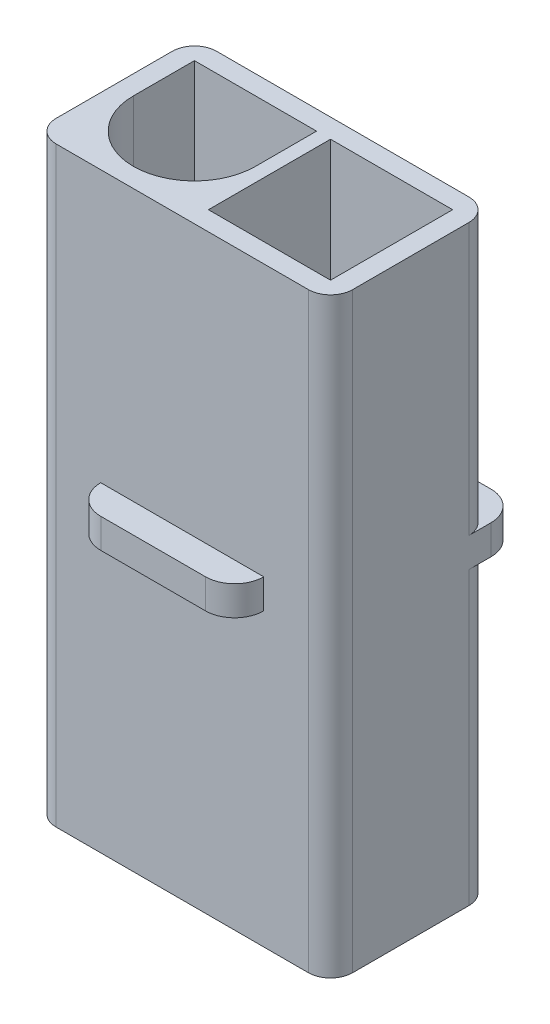
from build123d import *

# Parameters (mm, degrees)
SKETCH1_W           = 13.36
SKETCH1_H           = 7.23
BOSS_EXTRUDE1_DEPTH = 13.325
SKETCH2_W           = 5.5
SKETCH2_H           = 5.5
CUT_EXTRUDE1_DEPTH  = 10
CUT_EXTRUDE2_START  = -11.75
SKETCH3_R           = 2.75
CUT_EXTRUDE2_DEPTH  = 11.75
BOSS_EXTRUDE2_DEPTH = 1.8
BOSS_EXTRUDE3_DEPTH = 1.33
FILLET1_R           = 1


with BuildPart() as part:
    # Sketch1 → Boss-Extrude1 (new, symmetric)
    with BuildSketch(Plane(origin=(0, 0, 0), x_dir=(1, 0, 0), z_dir=(0, 1, 0))):
        Rectangle(SKETCH1_W, SKETCH1_H)
    extrude(amount=BOSS_EXTRUDE1_DEPTH, both=True)

    # Sketch2 → Cut-Extrude1 (cut)
    with BuildSketch(Plane(origin=(0, 13.325, 0), x_dir=(1, 0, 0), z_dir=(0, 1, 0))):
        with BuildLine():
            Line((-5.815, 2.75), (-0.315, 2.75))
            Line((-0.315, 2.75), (-0.315, 0))
            ThreePointArc((-0.315, 0), (-3.065, -2.75), (-5.815, 0))
            Line((-5.815, 0), (-5.815, 2.75))
        make_face()
        with Locations((3.065, 0)):
            Rectangle(SKETCH2_W, SKETCH2_H)
    extrude(amount=-CUT_EXTRUDE1_DEPTH, mode=Mode.SUBTRACT)

    # Sketch3 → Cut-Extrude2 (cut)
    with BuildSketch(Plane.XZ.offset(13.325).offset(CUT_EXTRUDE2_START)):
        with Locations(Location((-3.065, 0, 0), (0, 0, 270))):
            Circle(SKETCH3_R)
        with Locations(Location((3.065, 0, 0), (0, 0, 270))):
            Circle(SKETCH3_R)
    extrude(amount=CUT_EXTRUDE2_DEPTH, mode=Mode.SUBTRACT)

    # Sketch4 → Boss-Extrude2 (add, symmetric)
    with BuildSketch(Plane(origin=(0, 0, 0), x_dir=(0, 0, -1), z_dir=(1, 0, 0))):
        Polygon((3.615, 13.325), (5.145, 10.975), (3.615, 10.975), align=None)
    extrude(amount=BOSS_EXTRUDE2_DEPTH, both=True)

    # Sketch5 → Boss-Extrude3 (add)
    with BuildSketch(Plane(origin=(0, -0.215, 0), x_dir=(1, 0, 0), z_dir=(0, 1, 0))):
        with BuildLine():
            Line((-5.37, 4.925), (-4.56, 4.925))
            ThreePointArc((-4.56, 4.925), (-3.633690117, 4.541309883), (-3.25, 3.615))
            Line((-3.25, 3.615), (-6.68, 3.615))
            ThreePointArc((-6.68, 3.615), (-6.296309883, 4.541309883), (-5.37, 4.925))
        make_face()
        with BuildLine():
            Line((4.56, 4.925), (5.37, 4.925))
            ThreePointArc((5.37, 4.925), (6.296309883, 4.541309883), (6.68, 3.615))
            Line((6.68, 3.615), (3.25, 3.615))
            ThreePointArc((3.25, 3.615), (3.633690117, 4.541309883), (4.56, 4.925))
        make_face()
        with BuildLine():
            Line((-2.36, -4.925), (2.36, -4.925))
            ThreePointArc((2.36, -4.925), (3.286309883, -4.541309883), (3.67, -3.615))
            Line((3.67, -3.615), (-3.67, -3.615))
            ThreePointArc((-3.67, -3.615), (-3.286309883, -4.541309883), (-2.36, -4.925))
        make_face()
    extrude(amount=BOSS_EXTRUDE3_DEPTH)

    # Fillet1
    fillet1_edges = [part.edges().sort_by_distance(p)[0] for p in [
        (-6.68, -6.77, -3.615),
        (6.68, -6.77, -3.615),
        (6.68, 0, 3.615),
        (-6.68, 0, 3.615),
        (-6.68, 7.22, -3.615),
        (6.68, 7.22, -3.615),
    ]]
    fillet(fillet1_edges, radius=FILLET1_R)


solid = part.part
